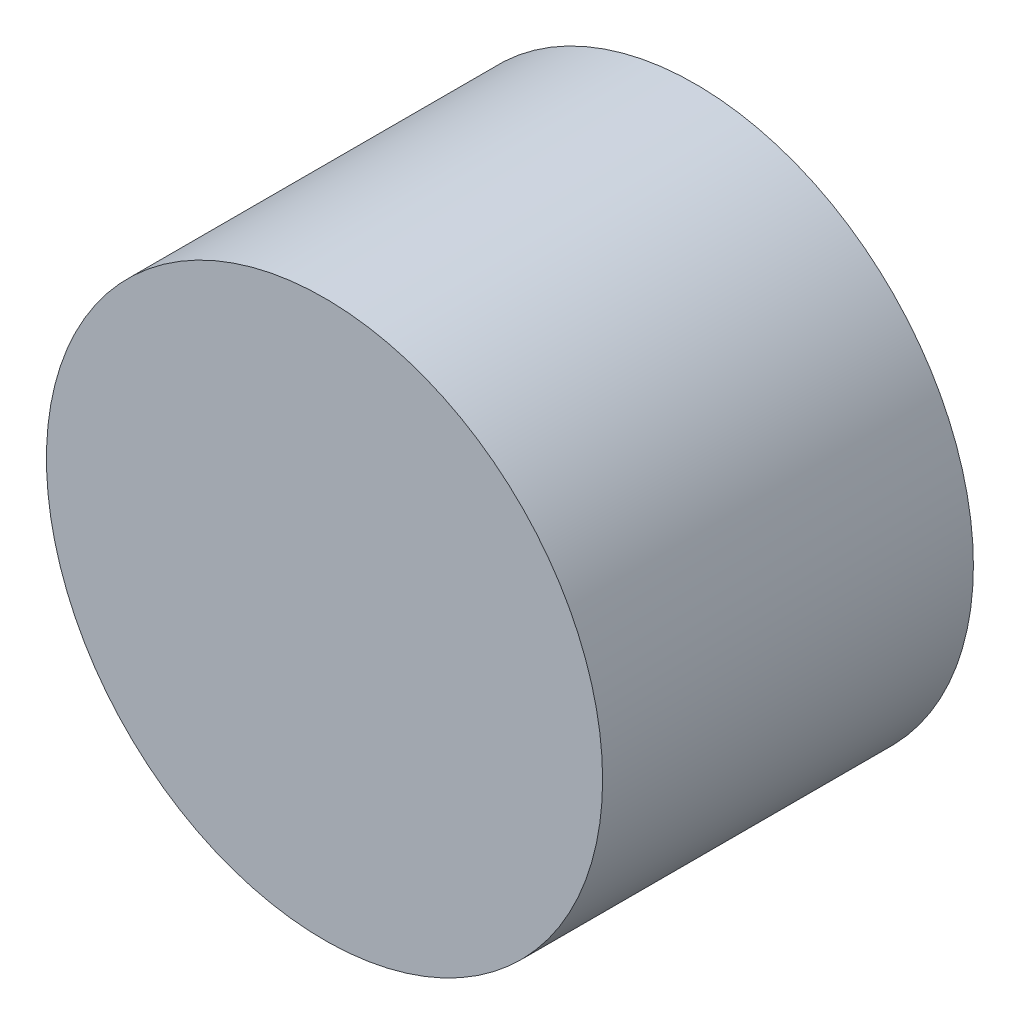
from build123d import *

# Parameters (mm, degrees)
SKETCH_1_R      = 30
EXTRUDE_1_DEPTH = 40


with BuildPart() as part:
    # ｽｹｯﾁ1 → ﾎﾞｽ - 押し出し1 (new body)
    with BuildSketch(Plane.XY):
        Circle(SKETCH_1_R)
    extrude(amount=EXTRUDE_1_DEPTH)


solid = part.part
